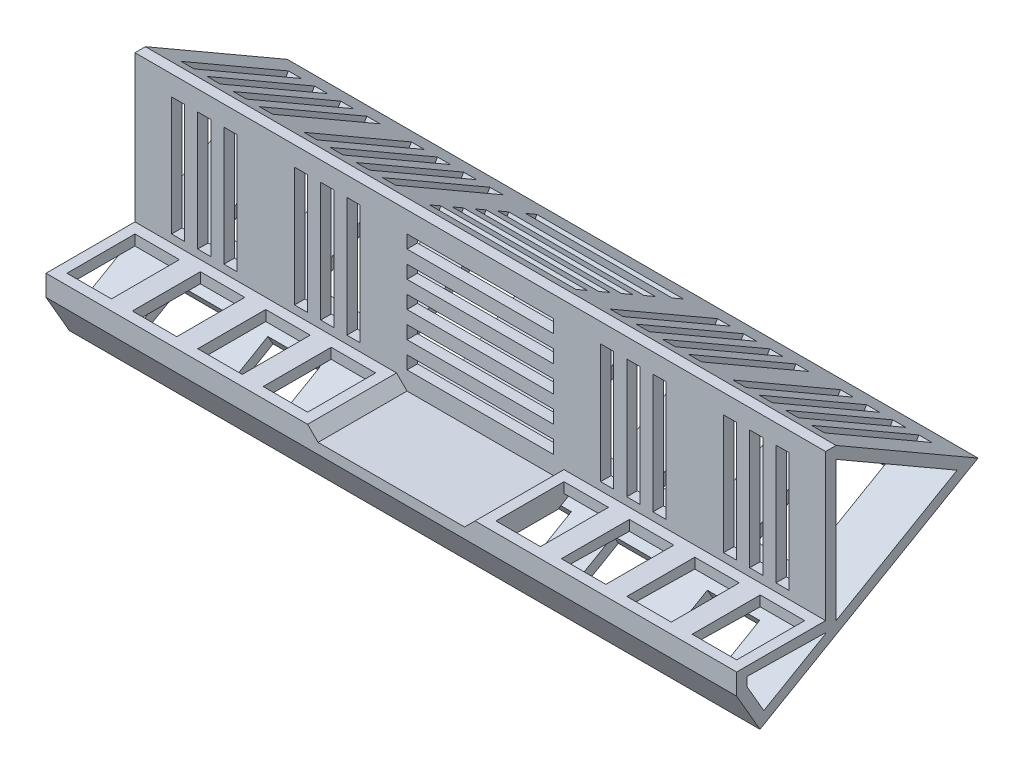
from build123d import *

# Parameters (mm, degrees)
EXTRUDE_2_DEPTH     = 17
EXTRUDE_6_DEPTH     = 132
SKETCH_9_W          = 2.5
SKETCH_9_H          = 23.704789932
SKETCH_9_W_2        = 28
SKETCH_9_H_2        = 2.5
CUT_EXTRUDE_2_DEPTH = 2
SKETCH_10_W         = 2.5
SKETCH_10_H         = 22.690598923
SKETCH_10_H_2       = 22.809970747
SKETCH_10_W_2       = 28
SKETCH_10_H_3       = 2.5
CUT_EXTRUDE_3_DEPTH = 2
EXTRUDE_7_DEPTH     = 132
SKETCH_11_W         = 8.5
SKETCH_11_H         = 13
CUT_EXTRUDE_6_DEPTH = 2
CUT_EXTRUDE_7_DEPTH = 48
CUT_EXTRUDE_8_DEPTH = 48
SKETCH_16_W         = 10
SKETCH_16_H         = 18.704789932
SKETCH_16_H_2       = 7.637986091
CUT_EXTRUDE_9_DEPTH = 2


with BuildPart() as part:
    # 草图4 → 凸台-拉伸2 (new body)
    with BuildSketch(Plane.XY):
        Polygon((-105.5, -67.1), (-155.5, -67.1), (-155.5, -69.1), (-155.5, -71.1), (-153.5, -71.1), (-25.5, -71.1), (-23.5, -71.1), (-23.5, -69.1), (-23.5, -67.1), (-73.5, -67.1), (-75.5, -69.1), (-103.5, -69.1), align=None)
    extrude(amount=EXTRUDE_2_DEPTH)

    # 草图7 → 凸台-拉伸6 (add)
    with BuildSketch(Plane.ZY.offset(155.5)):
        Polygon((0, -39.1), (-2, -39.1), (-29.127026483, -54.761796043), (-0.828427125, -71.1), (0, -71.1), align=None)
        Polygon((-25.127026483, -54.761796043), (-2, -68.114191008), (-2, -41.409401077), align=None, mode=Mode.SUBTRACT)
    extrude(amount=-EXTRUDE_6_DEPTH)

    # 草图9 → 切除-拉伸2 (cut)
    with BuildSketch(Plane(origin=(0, -30.221223201, 13.378492526), x_dir=(1, 0, 0), z_dir=(0, 0.8660254037844386, -0.5000000000000003))):
        with Locations((-139.75, 32.264649103)):
            Rectangle(SKETCH_9_W, SKETCH_9_H)
        with Locations((-89.5, 26.662254137)):
            Rectangle(SKETCH_9_W_2, SKETCH_9_H_2)
        with Locations((-144.75, 32.264649103)):
            Rectangle(SKETCH_9_W, SKETCH_9_H)
        with Locations((-134.75, 32.264649103)):
            Rectangle(SKETCH_9_W, SKETCH_9_H)
        with Locations((-149.75, 32.264649103)):
            Rectangle(SKETCH_9_W, SKETCH_9_H)
        with Locations((-126.25, 32.264649103)):
            Rectangle(SKETCH_9_W, SKETCH_9_H)
        with Locations((-121.25, 32.264649103)):
            Rectangle(SKETCH_9_W, SKETCH_9_H)
        with Locations((-116.25, 32.264649103)):
            Rectangle(SKETCH_9_W, SKETCH_9_H)
        with Locations((-111.25, 32.264649103)):
            Rectangle(SKETCH_9_W, SKETCH_9_H)
        with Locations((-67.75, 32.264649103)):
            Rectangle(SKETCH_9_W, SKETCH_9_H)
        with Locations((-62.75, 32.264649103)):
            Rectangle(SKETCH_9_W, SKETCH_9_H)
        with Locations((-57.75, 32.264649103)):
            Rectangle(SKETCH_9_W, SKETCH_9_H)
        with Locations((-52.75, 32.264649103)):
            Rectangle(SKETCH_9_W, SKETCH_9_H)
        with Locations((-44.25, 32.264649103)):
            Rectangle(SKETCH_9_W, SKETCH_9_H)
        with Locations((-39.25, 32.264649103)):
            Rectangle(SKETCH_9_W, SKETCH_9_H)
        with Locations((-34.25, 32.264649103)):
            Rectangle(SKETCH_9_W, SKETCH_9_H)
        with Locations((-29.25, 32.264649103)):
            Rectangle(SKETCH_9_W, SKETCH_9_H)
        with Locations((-89.5, 21.662254137)):
            Rectangle(SKETCH_9_W_2, SKETCH_9_H_2)
        with Locations((-89.5, 42.867044069)):
            Rectangle(SKETCH_9_W_2, SKETCH_9_H_2)
        with Locations((-89.5, 31.662254137)):
            Rectangle(SKETCH_9_W_2, SKETCH_9_H_2)
        with Locations((-89.5, 36.662254137)):
            Rectangle(SKETCH_9_W_2, SKETCH_9_H_2)
    extrude(amount=-CUT_EXTRUDE_2_DEPTH, mode=Mode.SUBTRACT)

    # 草图10 → 切除-拉伸3 (cut)
    with BuildSketch(Plane.XY):
        with Locations((-142.25, -54.254700539)):
            Rectangle(SKETCH_10_W, SKETCH_10_H)
        with Locations((-137.25, -54.254700539)):
            Rectangle(SKETCH_10_W, SKETCH_10_H)
        with Locations((-123.75, -54.195014627)):
            Rectangle(SKETCH_10_W, SKETCH_10_H_2)
        with Locations((-118.75, -54.195014627)):
            Rectangle(SKETCH_10_W, SKETCH_10_H_2)
        with Locations((-113.75, -54.195014627)):
            Rectangle(SKETCH_10_W, SKETCH_10_H_2)
        with Locations((-65.25, -54.195014627)):
            Rectangle(SKETCH_10_W, SKETCH_10_H_2)
        with Locations((-60.25, -54.195014627)):
            Rectangle(SKETCH_10_W, SKETCH_10_H_2)
        with Locations((-55.25, -54.195014627)):
            Rectangle(SKETCH_10_W, SKETCH_10_H_2)
        with Locations((-41.75, -54.195014627)):
            Rectangle(SKETCH_10_W, SKETCH_10_H_2)
        with Locations((-36.75, -54.195014627)):
            Rectangle(SKETCH_10_W, SKETCH_10_H_2)
        with Locations((-31.75, -54.195014627)):
            Rectangle(SKETCH_10_W, SKETCH_10_H_2)
        with Locations((-89.5, -59.35)):
            Rectangle(SKETCH_10_W_2, SKETCH_10_H_3)
        with Locations((-89.5, -64.35)):
            Rectangle(SKETCH_10_W_2, SKETCH_10_H_3)
        with Locations((-89.5, -54.35)):
            Rectangle(SKETCH_10_W_2, SKETCH_10_H_3)
        with Locations((-89.5, -49.35)):
            Rectangle(SKETCH_10_W_2, SKETCH_10_H_3)
        with Locations((-89.5, -44.35)):
            Rectangle(SKETCH_10_W_2, SKETCH_10_H_3)
        with Locations((-147.25, -54.254700539)):
            Rectangle(SKETCH_10_W, SKETCH_10_H)
    extrude(amount=-CUT_EXTRUDE_3_DEPTH, mode=Mode.SUBTRACT)

    # 草图12 → 凸台-拉伸7 (add)
    with BuildSketch(Plane.ZY.offset(155.5)):
        Polygon((3.171572875, -71.1), (-0.828427125, -71.1), (12.542893219, -78.8199354), (17, -71.1), (14.690598923, -71.1), (11.810842411, -76.087884592), align=None)
    extrude(amount=-EXTRUDE_7_DEPTH)

    # 草图11 → 切除-拉伸6 (cut)
    with BuildSketch(Plane(origin=(0, -67.1, 0), x_dir=(1, 0, 0), z_dir=(0, 1, 0))):
        with Locations((-149.25, -8.5)):
            Rectangle(SKETCH_11_W, SKETCH_11_H)
        with Locations((-111.75, -8.5)):
            Rectangle(SKETCH_11_W, SKETCH_11_H)
        with Locations((-136.75, -8.5)):
            Rectangle(SKETCH_11_W, SKETCH_11_H)
        with Locations((-124.25, -8.5)):
            Rectangle(SKETCH_11_W, SKETCH_11_H)
        with Locations((-67.25, -8.5)):
            Rectangle(SKETCH_11_W, SKETCH_11_H)
        with Locations((-54.75, -8.5)):
            Rectangle(SKETCH_11_W, SKETCH_11_H)
        with Locations((-42.25, -8.5)):
            Rectangle(SKETCH_11_W, SKETCH_11_H)
        with Locations((-29.75, -8.5)):
            Rectangle(SKETCH_11_W, SKETCH_11_H)
    extrude(amount=-CUT_EXTRUDE_6_DEPTH, mode=Mode.SUBTRACT)

    # 草图13 → 切除-拉伸7 (cut)
    with BuildSketch(Plane.ZY.offset(155.5)):
        Polygon((0, -69.1), (15, -69.1), (15, -70.564101615), (14.690598923, -71.1), (3.171572875, -71.1), (0, -69.268891547), align=None)
    extrude(amount=-CUT_EXTRUDE_7_DEPTH, mode=Mode.SUBTRACT)

    # 草图15 → 切除-拉伸8 (cut)
    with BuildSketch(Plane(origin=(-23.5, 0, 0), x_dir=(0, 0, -1), z_dir=(1, 0, 0))):
        Polygon((-15, -68.832050808), (-15, -70.564101615), (-14.690598923, -71.1), (-3.171572875, -71.1), (0, -69.268891547), (0, -69.1), align=None)
    extrude(amount=-CUT_EXTRUDE_8_DEPTH, mode=Mode.SUBTRACT)

    # 草图16 → 切除-拉伸9 (cut)
    with BuildSketch(Plane(origin=(0, -53.683719468, -30.994309886), x_dir=(1, 0, 0), z_dir=(0, -0.8660254037844385, -0.5000000000000003))):
        with Locations((-140.5, 18.972649731)):
            Rectangle(SKETCH_16_W, SKETCH_16_H)
        with Locations((-140.5, 41.453438819)):
            Rectangle(SKETCH_16_W, SKETCH_16_H_2)
        with Locations((-104.5, 18.972649731)):
            Rectangle(SKETCH_16_W, SKETCH_16_H)
        with Locations((-122.5, 18.972649731)):
            Rectangle(SKETCH_16_W, SKETCH_16_H)
        with Locations((-74.5, 18.972649731)):
            Rectangle(SKETCH_16_W, SKETCH_16_H)
        with Locations((-56.5, 18.972649731)):
            Rectangle(SKETCH_16_W, SKETCH_16_H)
        with Locations((-38.5, 18.972649731)):
            Rectangle(SKETCH_16_W, SKETCH_16_H)
        with Locations((-104.5, 41.453438819)):
            Rectangle(SKETCH_16_W, SKETCH_16_H_2)
        with Locations((-122.5, 41.453438819)):
            Rectangle(SKETCH_16_W, SKETCH_16_H_2)
        with Locations((-74.5, 41.453438819)):
            Rectangle(SKETCH_16_W, SKETCH_16_H_2)
        with Locations((-56.5, 41.453438819)):
            Rectangle(SKETCH_16_W, SKETCH_16_H_2)
        with Locations((-38.5, 41.453438819)):
            Rectangle(SKETCH_16_W, SKETCH_16_H_2)
    extrude(amount=-CUT_EXTRUDE_9_DEPTH, mode=Mode.SUBTRACT)


solid = part.part
